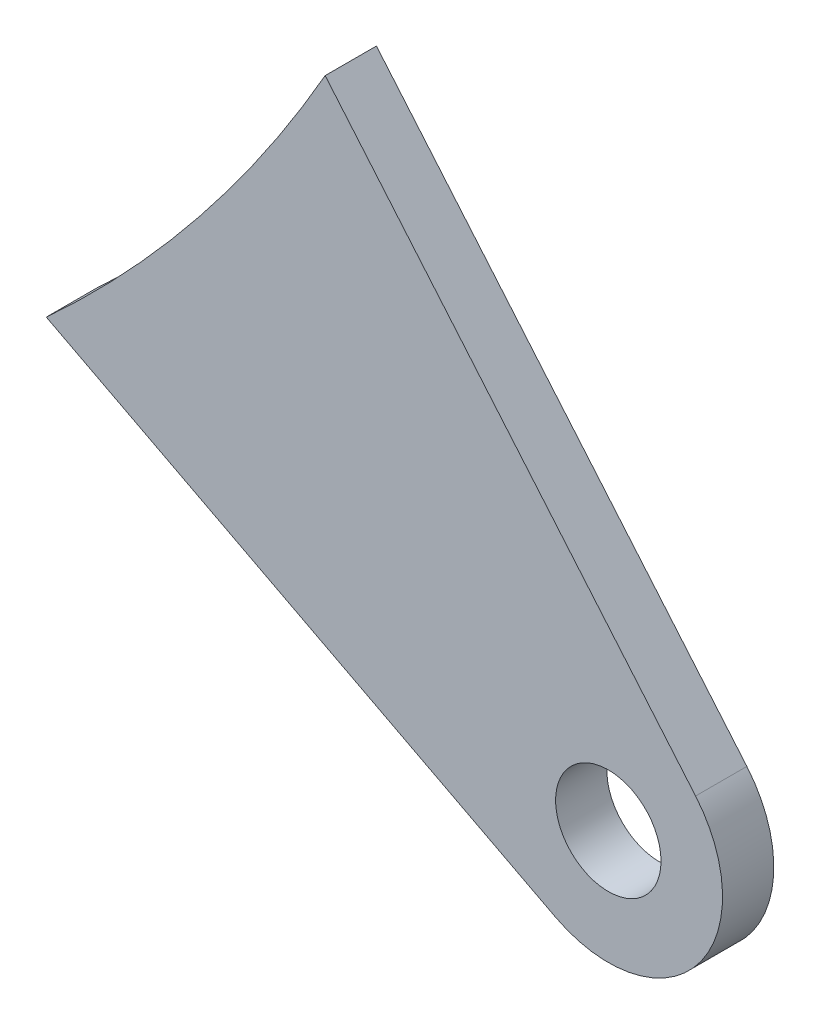
from build123d import *

# Parameters (mm, degrees)
SKETCH1_R           = 3.2639
BOSS_EXTRUDE1_DEPTH = 3.175


with BuildPart() as part:
    # Sketch1 → Boss-Extrude1 (new body)
    with BuildSketch(Plane.XY):
        with BuildLine():
            Line((54.046795642, -66.055825256), (85.589363144, -82.474717892))
            ThreePointArc((85.589363144, -82.474717892), (94.379337871, -80.619030297), (94.260258146, -71.636099139))
            Line((94.260258146, -71.636099139), (71.317848073, -44.467009717))
            ThreePointArc((71.317848073, -44.467009717), (63.520638853, -55.932071083), (54.046795642, -66.055825256))
        make_face()
        with Locations((88.85555, -76.2)):
            Circle(SKETCH1_R, mode=Mode.SUBTRACT)
    extrude(amount=BOSS_EXTRUDE1_DEPTH)


solid = part.part
